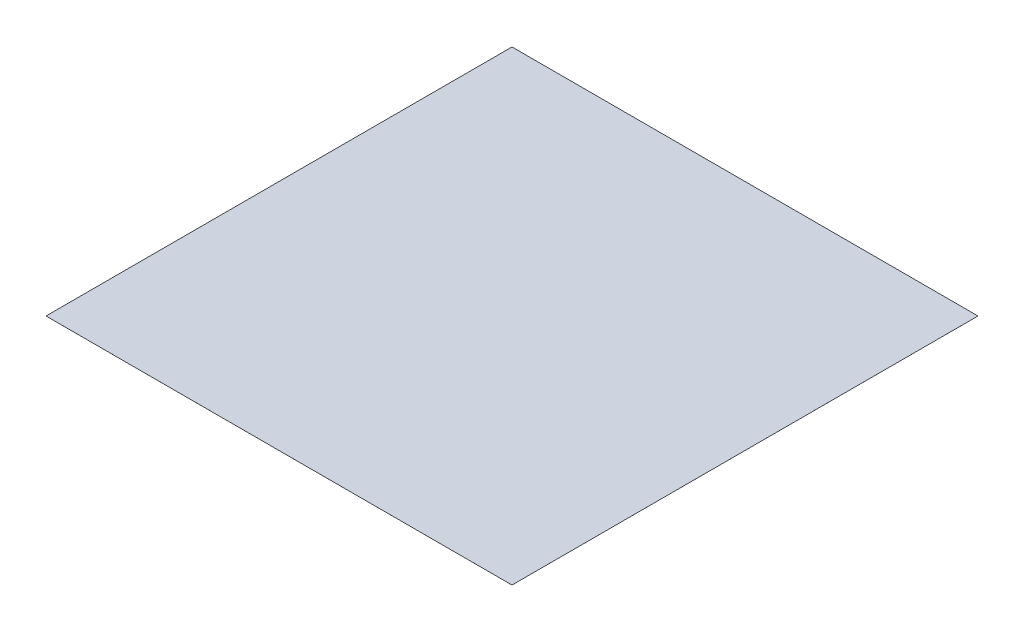
from build123d import *

# Parameters (mm, degrees)
ESBO_O1_W                = 5700
ESBO_O1_H                = 5700
RESSALTO_EXTRUS_O1_DEPTH = 0.1


with BuildPart() as part:
    # Esboço1 → Ressalto-extrusão1 (new body)
    with BuildSketch(Plane(origin=(0, 0, 0), x_dir=(1, 0, 0), z_dir=(0, 1, 0))):
        with Locations((217.001072909, 545.321398838)):
            Rectangle(ESBO_O1_W, ESBO_O1_H)
    extrude(amount=RESSALTO_EXTRUS_O1_DEPTH)


solid = part.part
